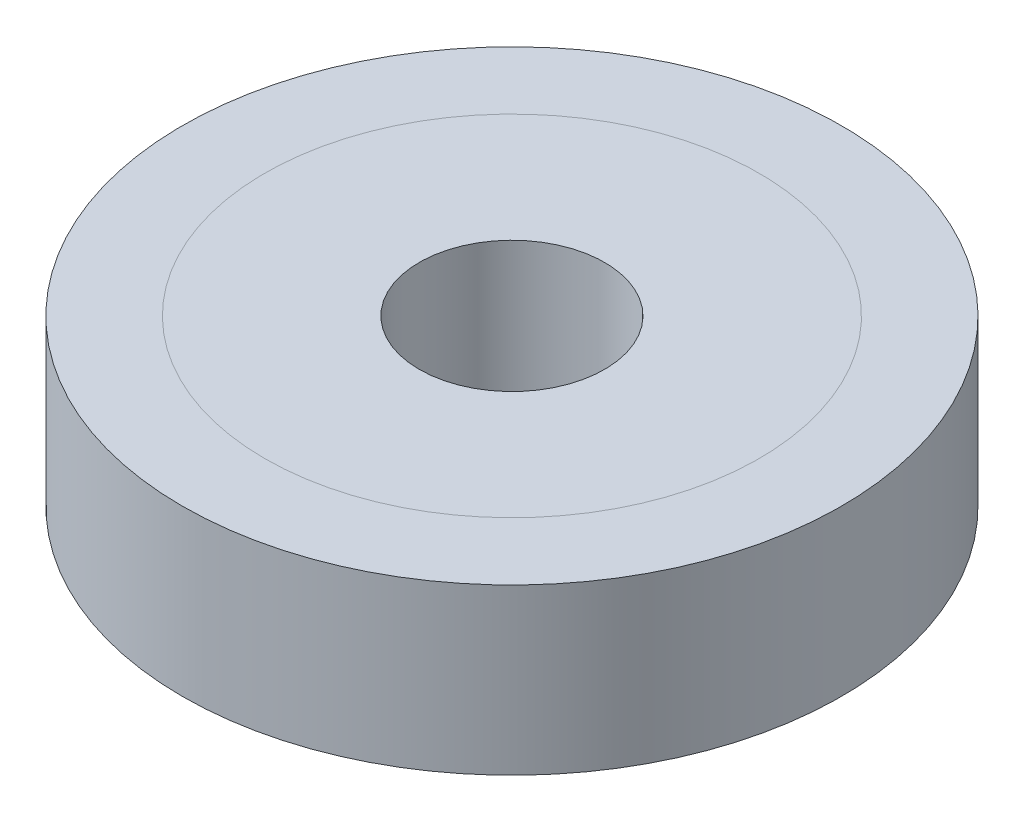
from build123d import *

# Parameters (mm, degrees)
SKETCH_1_R      = 12
SKETCH_1_R_2    = 4.5
EXTRUDE_1_DEPTH = 8
SKETCH_2_R      = 16
SKETCH_2_R_2    = 12
EXTRUDE_2_DEPTH = 8


with BuildPart() as part:
    # 草图1 → 凸台-拉伸1 (new body)
    with BuildSketch(Plane(origin=(0, 0, 0), x_dir=(1, 0, 0), z_dir=(0, 1, 0))):
        with Locations(Location((0, 0, 0), (0, 0, 270))):
            Circle(SKETCH_1_R)
        with Locations(Location((0, 0, 0), (0, 0, 270))):
            Circle(SKETCH_1_R_2, mode=Mode.SUBTRACT)
    extrude(amount=EXTRUDE_1_DEPTH)


with BuildPart() as body_2:
    # 草图2 → 凸台-拉伸2 (new body)
    with BuildSketch(Plane(origin=(0, 8, 0), x_dir=(1, 0, 0), z_dir=(0, 1, 0))):
        with Locations(Location((0, 0, 0), (0, 0, 270))):
            Circle(SKETCH_2_R)
        with Locations(Location((0, 0, 0), (0, 0, 270))):
            Circle(SKETCH_2_R_2, mode=Mode.SUBTRACT)
    extrude(amount=-EXTRUDE_2_DEPTH)


solid = Compound([part.part, body_2.part])
